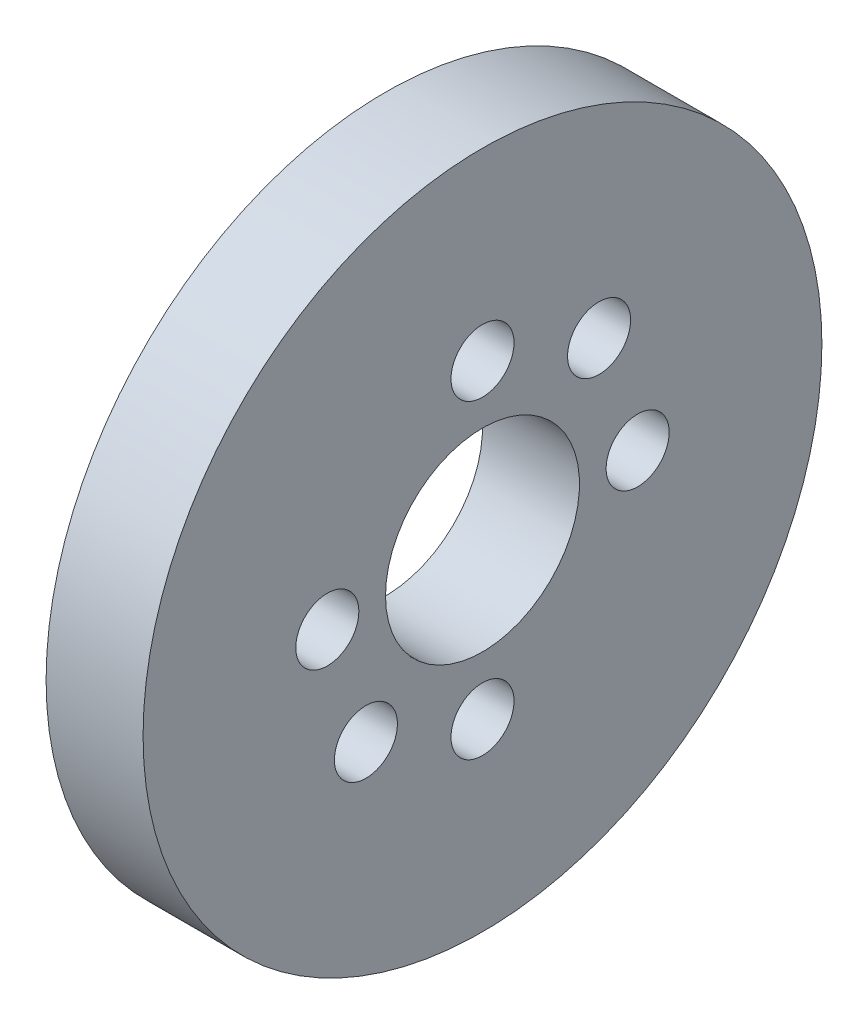
from build123d import *

# Parameters (mm, degrees)
SKETCH1_W        = 10
SKETCH1_H        = 25
DIAMETER_HOLE1_D = 6.5
DIAMETER_HOLE2_D = 6.5


with BuildPart() as part:
    # Sketch1 → Revolve1 (revolve)
    with BuildSketch(Plane.XY, mode=Mode.PRIVATE) as revolve1_sk:
        with Locations((5, 22.5)):
            Rectangle(SKETCH1_W, SKETCH1_H)
    revolve(revolve1_sk.sketch.rotate(Axis((0, 0, 0), (1, 0, 0)), 90), axis=Axis((0, 0, 0), (1, 0, 0)))

    # Diameter Hole1 (through all)
    with Locations(Plane(origin=(10, 0, 0), x_dir=(0, 0, -1), z_dir=(1, 0, 0))):
        with Locations((-16, 0), (0, 16), (16, 0), (0, -16)):
            Hole(DIAMETER_HOLE1_D / 2)

    # Diameter Hole2 (through all)
    with Locations(Plane(origin=(10, 0, 0), x_dir=(0, 0, -1), z_dir=(1, 0, 0))):
        with Locations((-12.02081528, -12.02081528), (12.02081528, 12.02081528)):
            Hole(DIAMETER_HOLE2_D / 2)


solid = part.part
